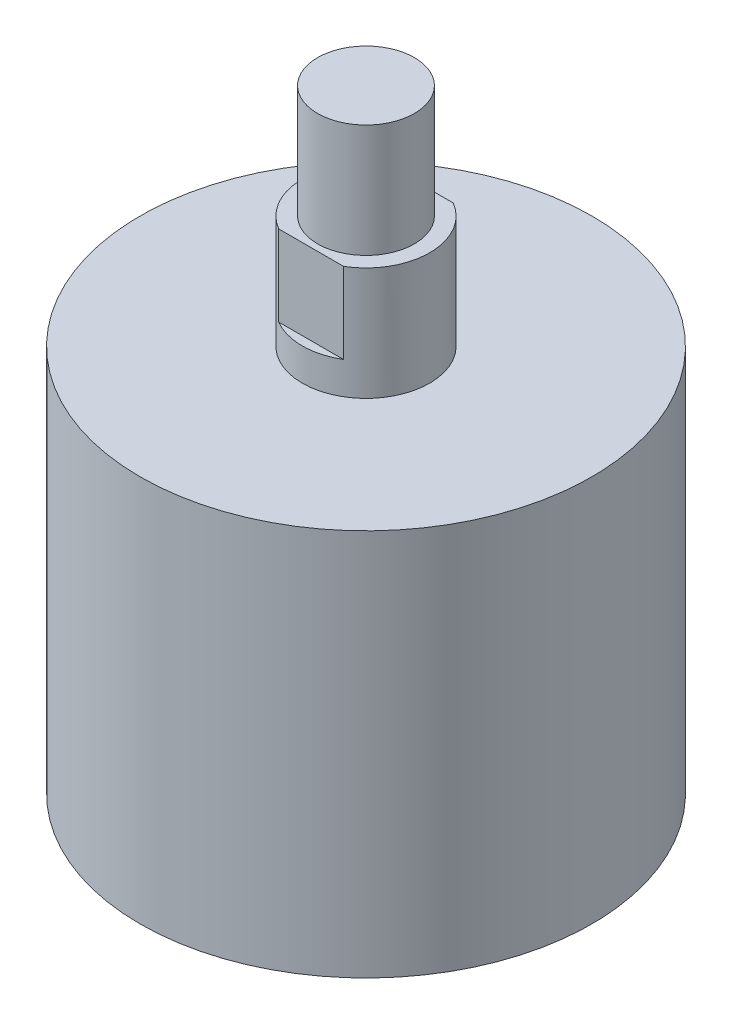
from build123d import *

# Parameters (mm, degrees)
SKETCH2_R           = 14
BOSS_EXTRUDE1_DEPTH = 24
SKETCH3_R           = 3.95
BOSS_EXTRUDE2_DEPTH = 7
SKETCH4_R           = 3
BOSS_EXTRUDE3_DEPTH = 7
SKETCH6_R           = 1.25
CUT_EXTRUDE1_DEPTH  = 5
EXTRUDE_START       = 3
SKETCH_1_R          = 3
EXTRUDE_1_DEPTH     = 3
CUT_EXTRUDE2_START  = -5
CUT_EXTRUDE2_DEPTH  = 5


with BuildPart() as part:
    # Sketch2 → Boss-Extrude1 (new body)
    with BuildSketch(Plane(origin=(0, 0, 0), x_dir=(1, 0, 0), z_dir=(0, 1, 0))):
        with Locations(Location((0, 0, 0), (0, 0, 270))):
            Circle(SKETCH2_R)
    extrude(amount=BOSS_EXTRUDE1_DEPTH)

    # Sketch3 → Boss-Extrude2 (add)
    with BuildSketch(Plane(origin=(0, 24, 0), x_dir=(1, 0, 0), z_dir=(0, 1, 0))):
        with Locations(Location((0, 0, 0), (0, 0, 270))):
            Circle(SKETCH3_R)
    extrude(amount=BOSS_EXTRUDE2_DEPTH)

    # Sketch4 → Boss-Extrude3 (add)
    with BuildSketch(Plane(origin=(0, 31, 0), x_dir=(1, 0, 0), z_dir=(0, 1, 0))):
        with Locations(Location((0, 0, 0), (0, 0, 270))):
            Circle(SKETCH4_R)
    extrude(amount=BOSS_EXTRUDE3_DEPTH)

    # Sketch6 → Cut-Extrude1 (cut)
    with BuildSketch(Plane.XZ):
        with Locations(Location((8, 0, 0), (0, 0, 270))):
            Circle(SKETCH6_R)
        with Locations(Location((0, -8, 0), (0, 0, 270))):
            Circle(SKETCH6_R)
        with Locations(Location((-8, 0, 0), (0, 0, 270))):
            Circle(SKETCH6_R)
        with Locations(Location((0, 8, 0), (0, 0, 270))):
            Circle(SKETCH6_R)
    extrude(amount=-CUT_EXTRUDE1_DEPTH, mode=Mode.SUBTRACT)

    # 草图1 → 凸台-拉伸1 (add)
    with BuildSketch(Plane.XZ.offset(EXTRUDE_START)):
        with Locations(Location((0, 0, 0), (0, 0, 90))):
            Circle(SKETCH_1_R)
    extrude(amount=-EXTRUDE_1_DEPTH)

    # Sketch7 → Cut-Extrude2 (cut)
    with BuildSketch(Plane(origin=(0, 31, 0), x_dir=(1, 0, 0), z_dir=(0, 1, 0)).offset(CUT_EXTRUDE2_START)):
        with BuildLine():
            Line((-2.010596926, 3.4), (2.010596926, 3.4))
            ThreePointArc((2.010596926, 3.4), (0, 3.95), (-2.010596926, 3.4))
        make_face()
        with BuildLine():
            Line((-2.010596926, -3.4), (2.010596926, -3.4))
            ThreePointArc((2.010596926, -3.4), (0, -3.95), (-2.010596926, -3.4))
        make_face()
    extrude(amount=CUT_EXTRUDE2_DEPTH, mode=Mode.SUBTRACT)


solid = part.part
